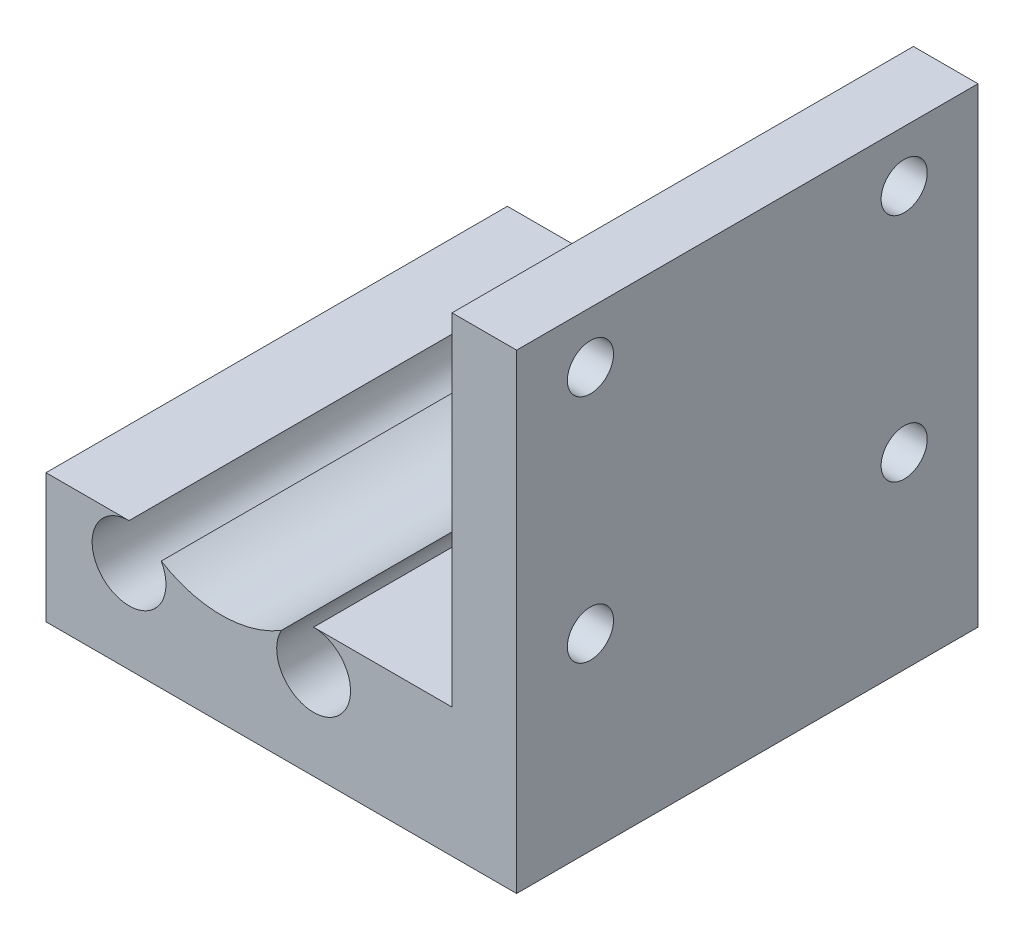
from build123d import *

# Parameters (mm, degrees)
BOSS_EXTRUDE1_DEPTH = 25
SKETCH5_R           = 2.5
CUT_EXTRUDE4_DEPTH  = 90
CHAMFER1_SIZE       = 2.7


with BuildPart() as part:
    # Sketch1 → Boss-Extrude1 (new, symmetric)
    with BuildSketch(Plane.XY):
        with BuildLine():
            Line((-10, -9.124404748), (-19, -9.124404748))
            Line((-19, -9.124404748), (-19, -23.124404748))
            Line((-19, -23.124404748), (32, -23.124404748))
            Line((32, -23.124404748), (32, 27.875595252))
            Line((32, 27.875595252), (25, 27.875595252))
            Line((25, 27.875595252), (25, -9.124404748))
            Line((25, -9.124404748), (10, -9.124404748))
            ThreePointArc((10, -9.124404748), (12.023420987, -16.574878268), (6.509119733, -11.171520993))
            ThreePointArc((6.509119733, -11.171520993), (0, -13), (-6.509119733, -11.171520993))
            ThreePointArc((-6.509119733, -11.171520993), (-12.023420987, -16.574878268), (-10, -9.124404748))
        make_face()
    extrude(amount=BOSS_EXTRUDE1_DEPTH, both=True)

    # Sketch5 → Cut-Extrude4 (cut)
    with BuildSketch(Plane(origin=(32, 0, 0), x_dir=(0, 0, -1), z_dir=(1, 0, 0))):
        with Locations(Location((17, -2.724404748, 0), (0, 0, 90))):
            Circle(SKETCH5_R)
        with Locations(Location((17, 22.275595252, 0), (0, 0, 90))):
            Circle(SKETCH5_R)
        with Locations(Location((-17, -2.724404748, 0), (0, 0, 90))):
            Circle(SKETCH5_R)
        with Locations(Location((-17, 22.275595252, 0), (0, 0, 90))):
            Circle(SKETCH5_R)
    extrude(amount=-CUT_EXTRUDE4_DEPTH, mode=Mode.SUBTRACT)

    # Chamfer1
    chamfer1_edges = [part.edges().sort_by_distance(p)[0] for p in [
        (25, 19.775595252, -17),
        (25, -5.224404748, 17),
        (25, 19.775595252, 17),
        (25, -5.224404748, -17),
    ]]
    chamfer(chamfer1_edges, length=CHAMFER1_SIZE)


solid = part.part
